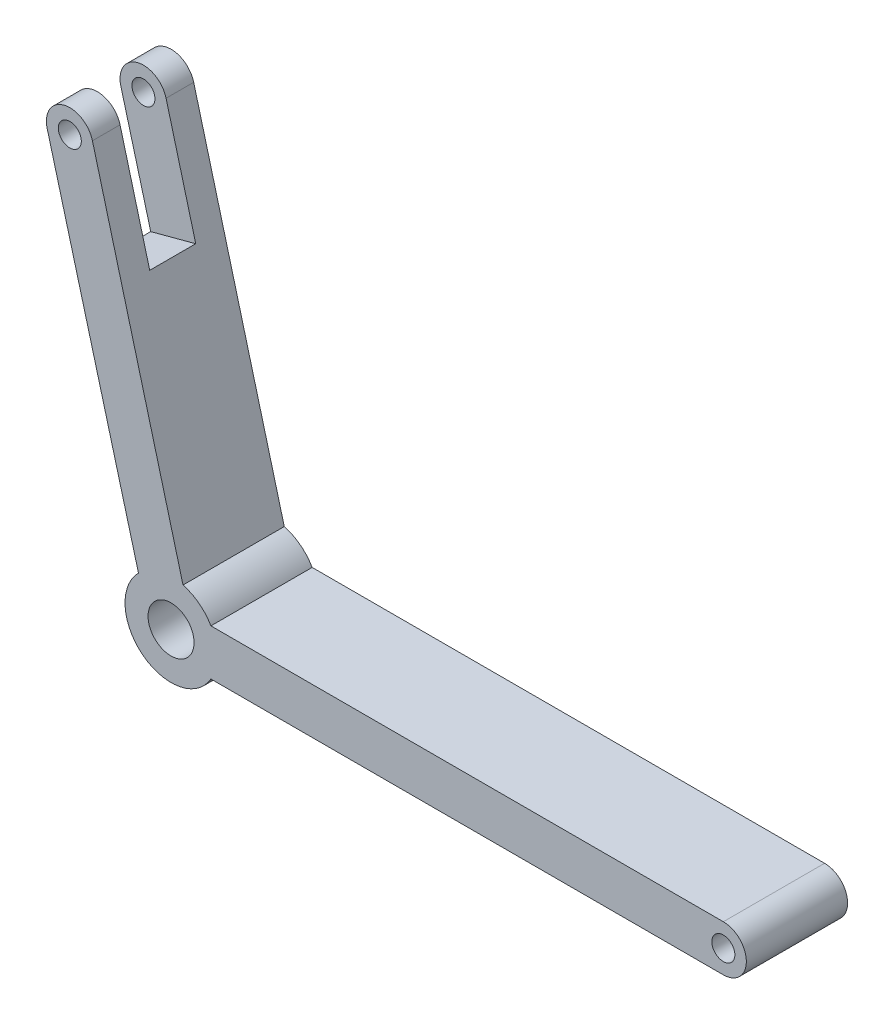
from build123d import *

# Parameters (mm, degrees)
SKETCH_1_R          = 2.5
SKETCH_1_R_2        = 5
EXTRUDE_1_DEPTH     = 11
SKETCH_1_2_R        = 5
SKETCH_1_2_R_2      = 2.5
EXTRUDE_2_DEPTH     = 11
SKETCH_3_R          = 2.5
CUT_EXTRUDE_1_DEPTH = 5


with BuildPart() as part:
    # 草图1 → 凸台-拉伸1 (new, symmetric)
    with BuildSketch(Plane.XY):
        with BuildLine():
            Line((82.916122479, 118.415426808), (102.598160303, 44.656581333))
            ThreePointArc((102.598160303, 44.656581333), (106.091708364, 42.93039023), (108.660254038, 40))
            Line((108.660254038, 40), (220, 40))
            ThreePointArc((220, 40), (225, 35), (220, 30))
            Line((220, 30), (108.660254038, 30))
            ThreePointArc((108.660254038, 30), (93.916481406, 27.063325538), (92.921636508, 42.063764596))
            Line((92.921636508, 42.063764596), (73.087358524, 115.781817444))
            ThreePointArc((73.087358524, 115.781817444), (76.683575783, 122.01807983), (82.916122479, 118.415426808))
        make_face()
        with Locations((78.000381166, 117.103695235)):
            Circle(SKETCH_1_R, mode=Mode.SUBTRACT)
        with Locations((220, 35)):
            Circle(SKETCH_1_R, mode=Mode.SUBTRACT)
        with Locations((100, 35)):
            Circle(SKETCH_1_R_2, mode=Mode.SUBTRACT)
    extrude(amount=EXTRUDE_1_DEPTH, both=True)

    # 草图1<2> → 凸台-拉伸2 (add, symmetric)
    with BuildSketch(Plane.XY):
        with BuildLine():
            Line((102.598160303, 44.656581333), (82.916122479, 118.415426808))
            ThreePointArc((82.916122479, 118.415426808), (76.683575783, 122.01807983), (73.087358524, 115.781817444))
            Line((73.087358524, 115.781817444), (92.921636508, 42.063764596))
            ThreePointArc((92.921636508, 42.063764596), (93.916481406, 27.063325538), (108.660254038, 30))
            Line((108.660254038, 30), (220, 30))
            ThreePointArc((220, 30), (225, 35), (220, 40))
            Line((220, 40), (108.660254038, 40))
            ThreePointArc((108.660254038, 40), (106.091708364, 42.93039023), (102.598160303, 44.656581333))
        make_face()
        with Locations((100, 35)):
            Circle(SKETCH_1_2_R, mode=Mode.SUBTRACT)
        with Locations((220, 35)):
            Circle(SKETCH_1_2_R_2, mode=Mode.SUBTRACT)
        with Locations((78.000381166, 117.103695235)):
            Circle(SKETCH_1_2_R_2, mode=Mode.SUBTRACT)
    extrude(amount=EXTRUDE_2_DEPTH, both=True)

    # 草图3 → 切除-拉伸1 (cut, symmetric)
    with BuildSketch(Plane.XY):
        with BuildLine():
            Line((89.361667081, 94.260614559), (82.916122479, 118.415426808))
            ThreePointArc((82.916122479, 118.415426808), (76.683575783, 122.01807983), (73.087358524, 115.781817444))
            Line((73.087358524, 115.781817444), (79.580043978, 91.650456081))
            Line((79.580043978, 91.650456081), (89.361667081, 94.260614559))
        make_face()
        with Locations((78.000381166, 117.103695235)):
            Circle(SKETCH_3_R, mode=Mode.SUBTRACT)
    extrude(amount=CUT_EXTRUDE_1_DEPTH, both=True, mode=Mode.SUBTRACT)


solid = part.part
